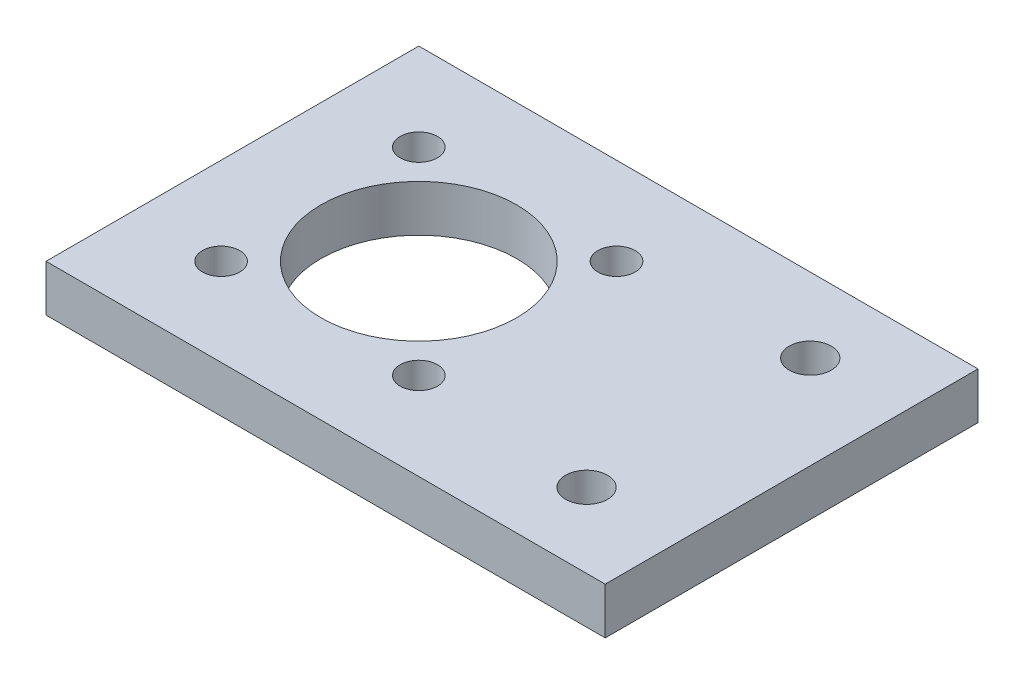
from build123d import *

# Parameters (mm, degrees)
SKETCH1_W           = 60
SKETCH1_H           = 40
BOSS_EXTRUDE1_DEPTH = 5
SKETCH4_R           = 2.25
CUT_EXTRUDE2_DEPTH  = 37.400549446
SKETCH6_R           = 10.5
SKETCH6_R_2         = 2
CUT_EXTRUDE3_DEPTH  = 37.400549446


with BuildPart() as part:
    # Sketch1 → Boss-Extrude1 (new body)
    with BuildSketch(Plane(origin=(0, 0, 0), x_dir=(1, 0, 0), z_dir=(0, 1, 0))):
        Rectangle(SKETCH1_W, SKETCH1_H)
    extrude(amount=BOSS_EXTRUDE1_DEPTH)

    # Sketch4 → Cut-Extrude2 (cut, through all)
    with BuildSketch(Plane(origin=(0, 5, 0), x_dir=(1, 0, 0), z_dir=(0, 1, 0))):
        with Locations(Location((20, 12, 0), (0, 0, 270))):
            Circle(SKETCH4_R)
        with Locations(Location((20, -12, 0), (0, 0, 90))):
            Circle(SKETCH4_R)
    extrude(amount=-CUT_EXTRUDE2_DEPTH, mode=Mode.SUBTRACT)

    # Sketch6 → Cut-Extrude3 (cut, through all)
    with BuildSketch(Plane(origin=(0, 5, 0), x_dir=(1, 0, 0), z_dir=(0, 1, 0))):
        with Locations(Location((-10.000056756, -7.4323e-05, 0), (0, 0, 270))):
            Circle(SKETCH6_R)
        with Locations(Location((-20.606658473, 10.606527395, 0), (0, 0, 270))):
            Circle(SKETCH6_R_2)
        with Locations(Location((0.606544962, 10.606527395, 0), (0, 0, 270))):
            Circle(SKETCH6_R_2)
        with Locations(Location((0.606544962, -10.606676041, 0), (0, 0, 270))):
            Circle(SKETCH6_R_2)
        with Locations(Location((-20.606658473, -10.606676041, 0), (0, 0, 270))):
            Circle(SKETCH6_R_2)
    extrude(amount=-CUT_EXTRUDE3_DEPTH, mode=Mode.SUBTRACT)


solid = part.part
